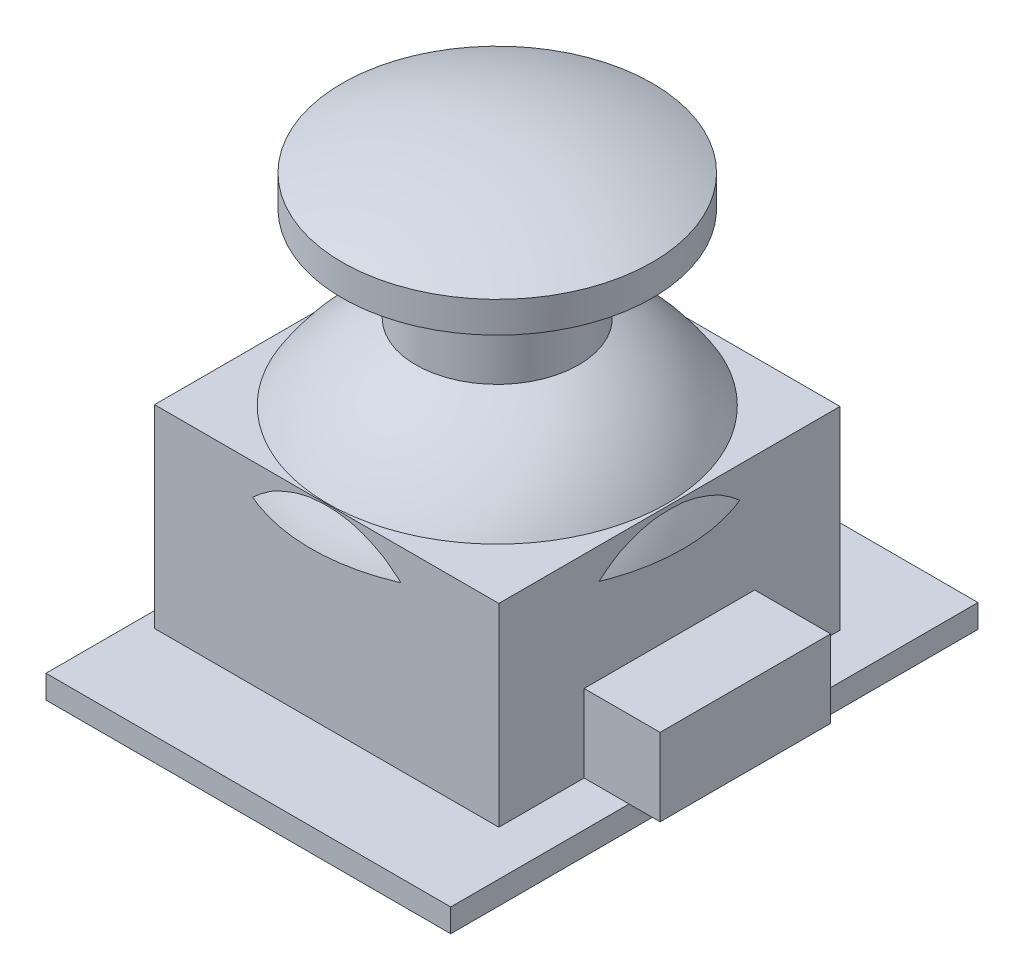
from build123d import *

# Parameters (mm, degrees)
SKETCH1_W           = 26.1
SKETCH1_H           = 34
BOSS_EXTRUDE1_DEPTH = 1.5
SKETCH2_W           = 22.2
SKETCH2_H           = 22
BOSS_EXTRUDE2_DEPTH = 12.5
SKETCH3_W           = 4.9
SKETCH3_H           = 11
BOSS_EXTRUDE3_DEPTH = 5
SKETCH4_R           = 2
BOSS_EXTRUDE4_DEPTH = 7.5
SKETCH5_W           = 0.5
SKETCH5_H           = 2.645751312
CUT_EXTRUDE1_DEPTH  = 6.5


with BuildPart() as part:
    # Sketch1 → Boss-Extrude1 (new body)
    with BuildSketch(Plane(origin=(0, 0, 0), x_dir=(1, 0, 0), z_dir=(0, 1, 0))):
        Rectangle(SKETCH1_W, SKETCH1_H)
    extrude(amount=BOSS_EXTRUDE1_DEPTH)


with BuildPart() as body_2:
    # Sketch2 → Boss-Extrude2 (new body)
    with BuildSketch(Plane(origin=(0, 1.5, 0), x_dir=(1, 0, 0), z_dir=(0, 1, 0))):
        with Locations((-0.95, 0)):
            Rectangle(SKETCH2_W, SKETCH2_H)
    extrude(amount=BOSS_EXTRUDE2_DEPTH)

    # Sketch3 → Boss-Extrude3 (add)
    with BuildSketch(Plane(origin=(0, 1.5, 0), x_dir=(1, 0, 0), z_dir=(0, 1, 0))):
        with Locations((12.6, 0)):
            Rectangle(SKETCH3_W, SKETCH3_H)
    extrude(amount=BOSS_EXTRUDE3_DEPTH)

    # Sketch4 → Boss-Extrude4 (add)
    with BuildSketch(Plane(origin=(0, 14, 0), x_dir=(1, 0, 0), z_dir=(0, 1, 0))):
        with Locations(Location((0, 0, 0), (0, 0, 270))):
            Circle(SKETCH4_R)
    extrude(amount=BOSS_EXTRUDE4_DEPTH)

    # Sketch5 → Cut-Extrude1 (cut)
    with BuildSketch(Plane(origin=(0, 21.5, 0), x_dir=(1, 0, 0), z_dir=(0, 1, 0))):
        with Locations((1.75, 0)):
            Rectangle(SKETCH5_W, SKETCH5_H)
    cut_extrude1 = extrude(amount=-CUT_EXTRUDE1_DEPTH, mode=Mode.SUBTRACT)

    # Mirror1: Cut-Extrude1 across plane
    add(cut_extrude1.mirror(Plane(origin=(0, 0, 0), x_dir=(0, 0, 1), z_dir=(1, 0, 0))), mode=Mode.SUBTRACT)


with BuildPart() as body_3:
    # Sketch9 → Revolve1 (revolve)
    with BuildSketch(Plane.XY):
        with BuildLine():
            Line((-0.95, 18.344051305), (-0.95, 29.2))
            ThreePointArc((-0.95, 29.2), (4.169570294, 28.643501338), (9.05, 27))
            Line((9.05, 27), (9.05, 25))
            Line((9.05, 25), (4.3, 25))
            Line((4.3, 25), (4.3, 18.892749892))
            ThreePointArc((4.3, 18.892749892), (8.338063591, 16.09570639), (11.05, 12))
            Line((11.05, 12), (10.506439237, 12))
            ThreePointArc((10.506439237, 12), (7.98521263, 15.741394355), (4.3, 18.344051305))
            Line((4.3, 18.344051305), (-0.95, 18.344051305))
        make_face()
    revolve(axis=Axis((-0.95, -961.886040234, 0), (0, 1, 0)))


solid = Compound([part.part, body_2.part, body_3.part])
